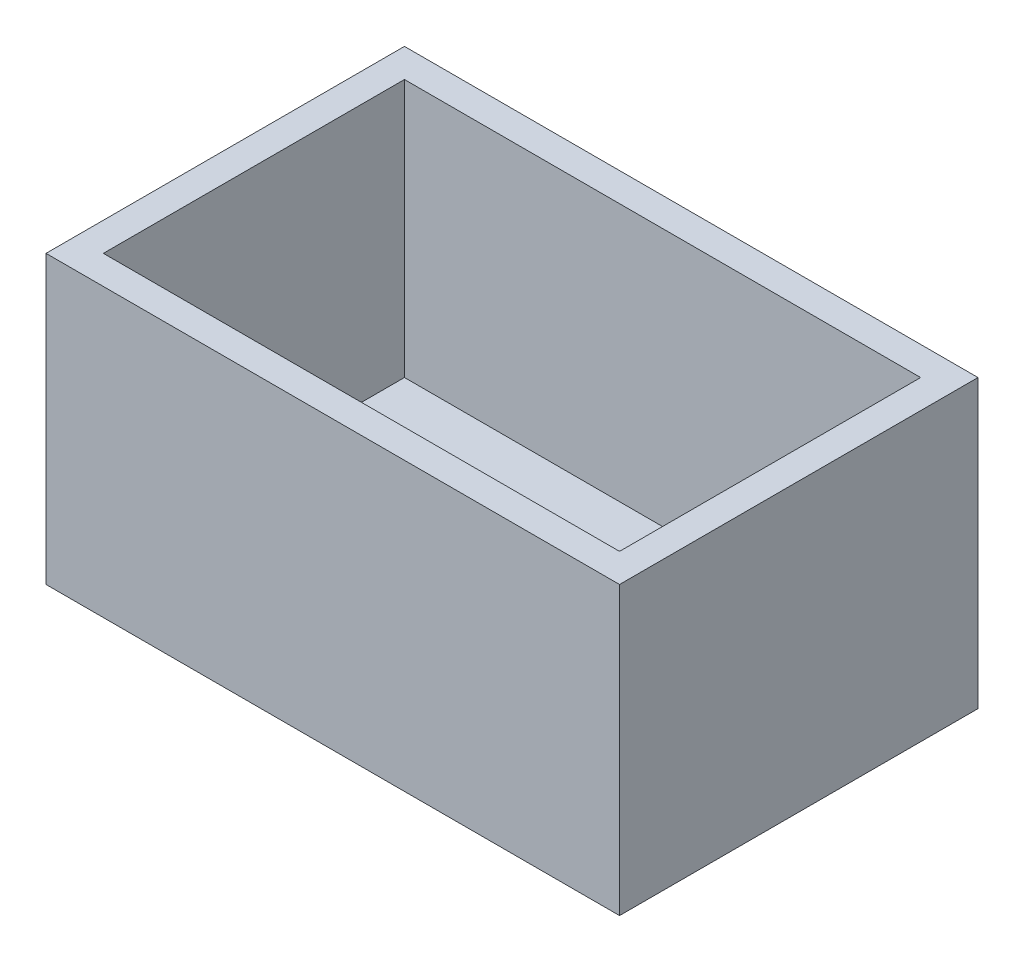
from build123d import *

# Parameters (mm, degrees)
SKETCH_1_W      = 80
SKETCH_1_H      = 50
EXTRUDE_1_DEPTH = 40
SHELL_1_T       = -4


with BuildPart() as part:
    # 草图1 → 凸台-拉伸1 (new body)
    with BuildSketch(Plane(origin=(0, 0, 0), x_dir=(1, 0, 0), z_dir=(0, 1, 0))):
        Rectangle(SKETCH_1_W, SKETCH_1_H)
    extrude(amount=EXTRUDE_1_DEPTH)

    # 抽壳1
    shell_1_openings = [part.faces().sort_by_distance(p)[0] for p in [
        (0, 40, 0),
    ]]
    offset(amount=SHELL_1_T, openings=shell_1_openings, kind=Kind.INTERSECTION)


solid = part.part
